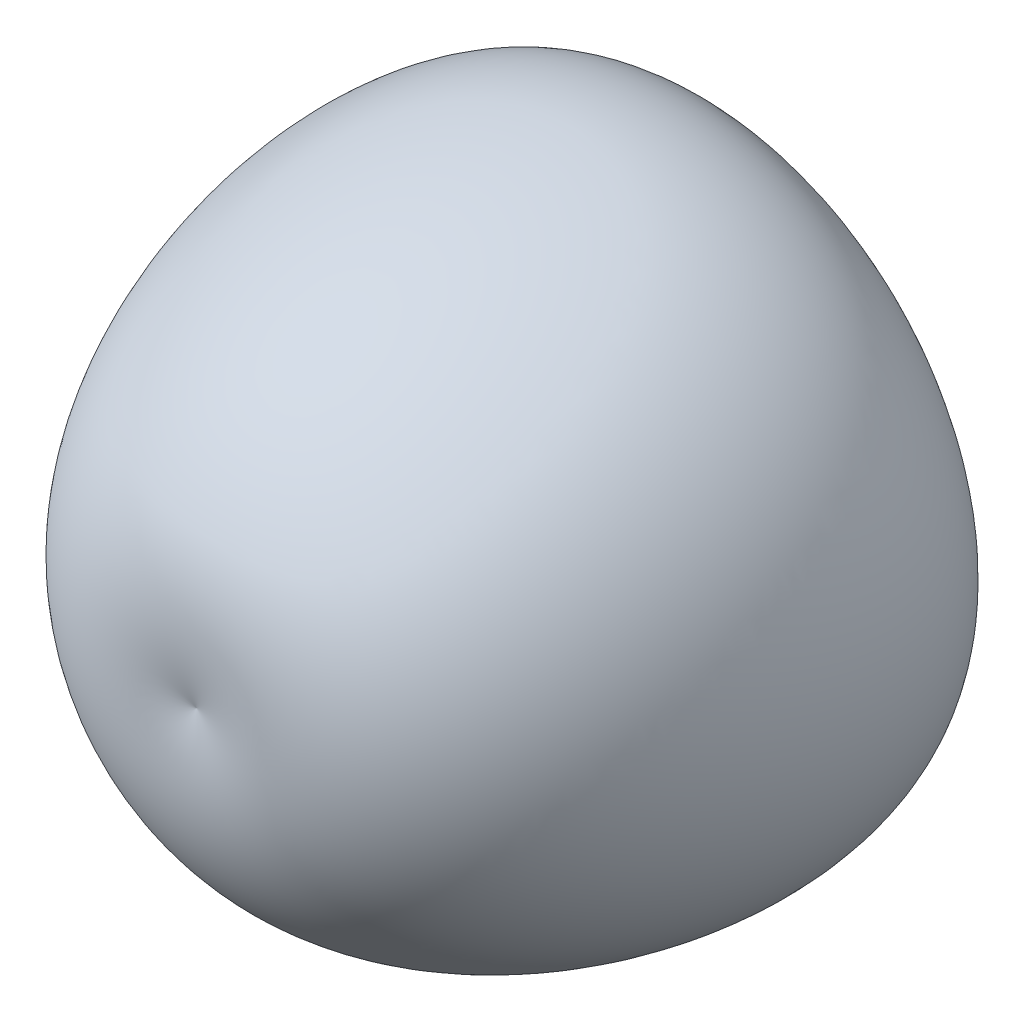
from build123d import *

# Parameters (mm, degrees)
SKETCH2_R           = 0.5
BOSS_EXTRUDE4_DEPTH = 22


with BuildPart() as part:
    # Sketch1 → Revolve1 (revolve)
    with BuildSketch(Plane(origin=(0, 0, 0), x_dir=(1, 0, 0), z_dir=(0, 1, 0))):
        with BuildLine():
            Line((0, 15), (0, 0))
            add(Edge.make_bspline(
                [(0, 15), (17.207476739, 30.218154333), (13.533494198, -3.921405225), (0, 0)],
                knots=[0, 0, 0, 0, 1, 1, 1, 1], degree=3))
        make_face()
    revolve(axis=Axis((0, 0, -15), (0, 0, 1)))

    # Sketch2 → Boss-Extrude4 (add)
    with BuildSketch(Plane.XY):
        Circle(SKETCH2_R)
    extrude(amount=-BOSS_EXTRUDE4_DEPTH)


solid = part.part
